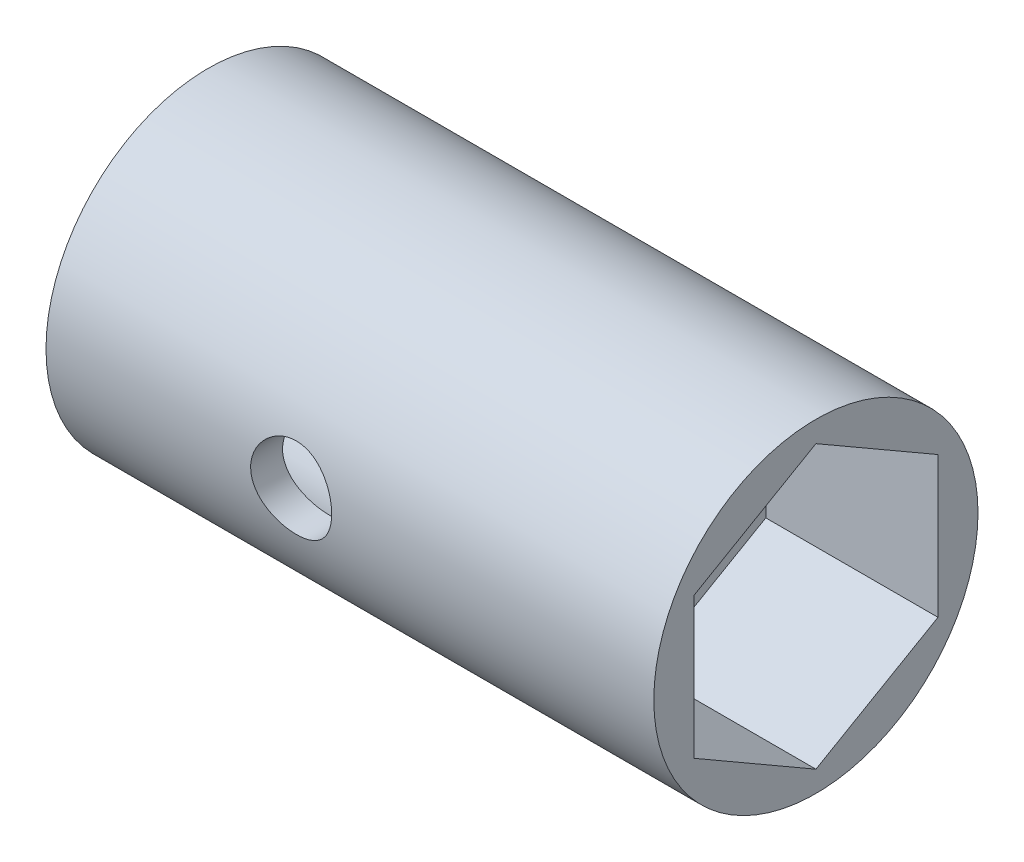
from build123d import *

# Parameters (mm, degrees)
CROQUIS1_R                 = 8
SALIENTE_EXTRUIR1_DEPTH    = 20
CORTAR_EXTRUIR1_DEPTH      = 8.5
CROQUIS3_R                 = 6.425
CORTAR_EXTRUIR2_DEPTH      = 9
CORTAR_EXTRUIR3_REACH      = 17.78
CROQUIS4_R                 = 2
CORTAR_EXTRUIR4_DEPTH      = 9
CORTAR_EXTRUIR4_DEPTH_BACK = 23.978250586
CROQUIS5_R                 = 2
SALIENTE_EXTRUIR2_START    = 10
CROQUIS6_R                 = 8
CROQUIS6_R_2               = 6.425
SALIENTE_EXTRUIR2_DEPTH    = 10


with BuildPart() as part:
    # Croquis1 → Saliente-Extruir1 (new body)
    with BuildSketch(Plane(origin=(0, 0, 0), x_dir=(0, 0, -1), z_dir=(1, 0, 0))):
        Circle(CROQUIS1_R)
    extrude(amount=SALIENTE_EXTRUIR1_DEPTH)

    # Croquis2 → Cortar-Extruir1 (cut)
    with BuildSketch(Plane(origin=(20, 0, 0), x_dir=(0, 0, -1), z_dir=(1, 0, 0))):
        Polygon((0, -6.957070744), (6.025, -3.478535372), (6.025, 3.478535372), (0, 6.957070744), (-6.025, 3.478535372), (-6.025, -3.478535372), align=None)
    extrude(amount=-CORTAR_EXTRUIR1_DEPTH, mode=Mode.SUBTRACT)

    # Croquis3 → Cortar-Extruir2 (cut)
    with BuildSketch(Plane.ZY):
        Circle(CROQUIS3_R)
    extrude(amount=-CORTAR_EXTRUIR2_DEPTH, mode=Mode.SUBTRACT)

    # Croquis4 → Cortar-Extruir3 (cut, up to next)
    with BuildSketch(Plane.ZY.offset(-9), mode=Mode.PRIVATE) as cortar_extruir3_sk1:
        Circle(CROQUIS4_R)
    cortar_extruir3_tool1 = extrude(cortar_extruir3_sk1.sketch, amount=-CORTAR_EXTRUIR3_REACH, mode=Mode.PRIVATE) & part.part
    add(cortar_extruir3_tool1.solids().sort_by_distance((9, 0, 0))[0], mode=Mode.SUBTRACT)

    # Croquis5 → Cortar-Extruir4 (cut, two sides: drawn at the far end of the back side and taken through both)
    with BuildSketch(Plane.XY.offset(-CORTAR_EXTRUIR4_DEPTH_BACK)):
        with Locations(Location((2.1, 0, 0), (0, 0, 180))):
            Circle(CROQUIS5_R)
    extrude(amount=CORTAR_EXTRUIR4_DEPTH + CORTAR_EXTRUIR4_DEPTH_BACK, mode=Mode.SUBTRACT)

    # Croquis6 → Saliente-Extruir2 (add)
    with BuildSketch(Plane.ZY.offset(SALIENTE_EXTRUIR2_START)):
        Circle(CROQUIS6_R)
        Circle(CROQUIS6_R_2, mode=Mode.SUBTRACT)
    extrude(amount=-SALIENTE_EXTRUIR2_DEPTH)


solid = part.part
